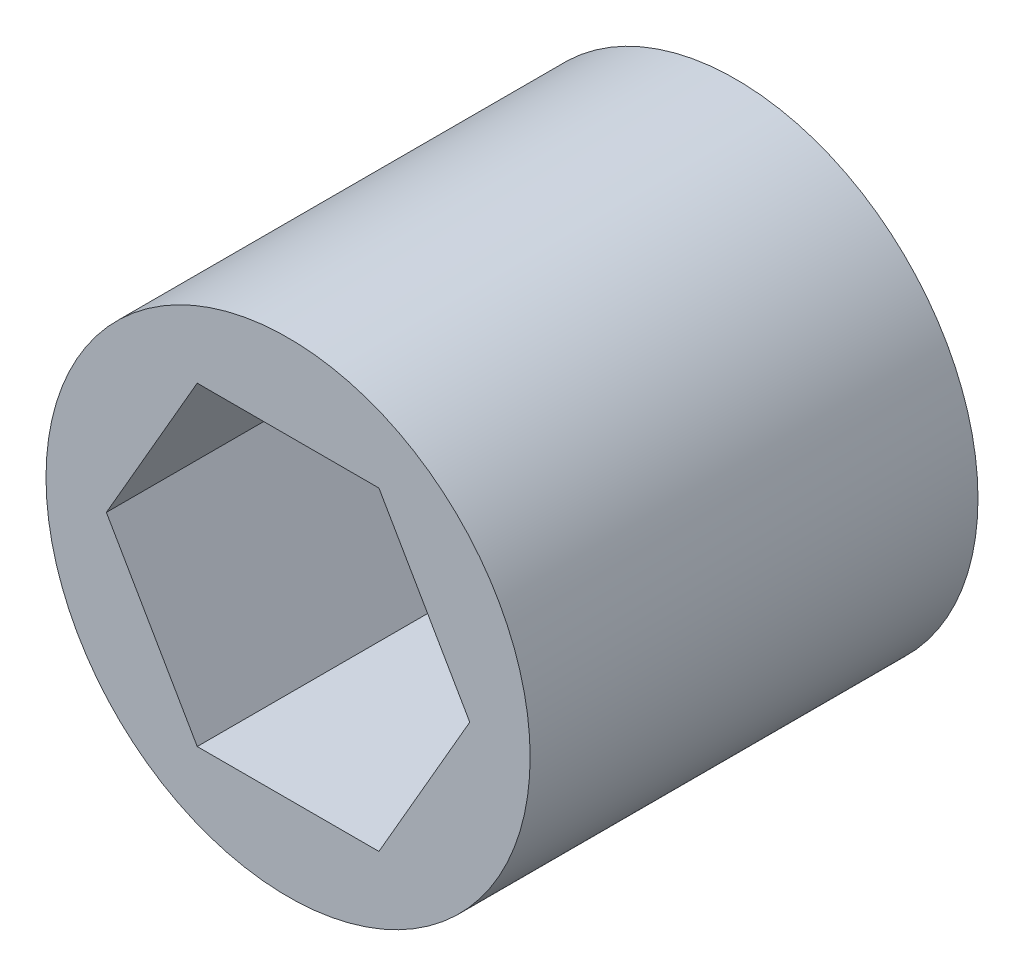
from build123d import *

# Parameters (mm, degrees)
SKETCH1_R                       = 2
BOSS_EXTRUDE1_SHAFTSOCKET_DEPTH = 1.85


with BuildPart() as part:
    # Sketch1 → Boss-Extrude1_ShaftSocket (new, symmetric)
    with BuildSketch(Plane.XY):
        Circle(SKETCH1_R)
        Polygon((1.5011107, 0), (0.75055535, 1.3), (-0.75055535, 1.3), (-1.5011107, 0), (-0.75055535, -1.3), (0.75055535, -1.3), align=None, mode=Mode.SUBTRACT)
    extrude(amount=BOSS_EXTRUDE1_SHAFTSOCKET_DEPTH, both=True)


solid = part.part
